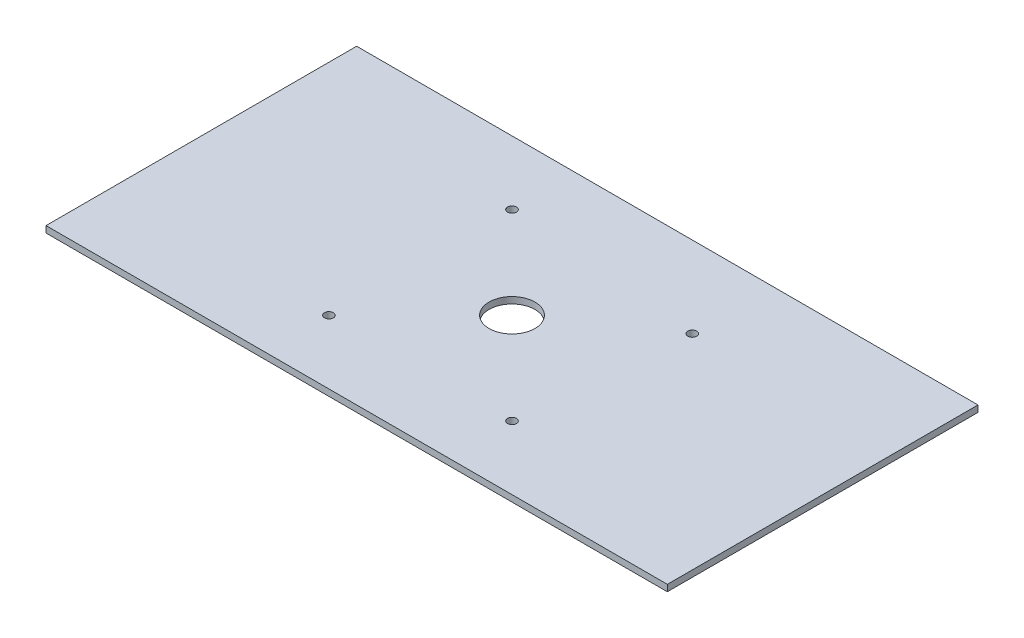
from build123d import *

# Parameters (mm, degrees)
SKETCH1_W           = 609.6
SKETCH1_H           = 304.8
SKETCH1_R           = 4.4
SKETCH1_R_2         = 22.5
BOSS_EXTRUDE1_DEPTH = 6.35


with BuildPart() as part:
    # Sketch1 → Boss-Extrude1 (new body)
    with BuildSketch(Plane(origin=(0, 0, 0), x_dir=(1, 0, 0), z_dir=(0, 1, 0))):
        Rectangle(SKETCH1_W, SKETCH1_H)
        with Locations(Location((-89.802561211, -89.802561211, 0), (0, 0, 270))):
            Circle(SKETCH1_R, mode=Mode.SUBTRACT)
        with Locations(Location((-89.802561211, 89.802561211, 0), (0, 0, 270))):
            Circle(SKETCH1_R, mode=Mode.SUBTRACT)
        with Locations(Location((104.032309625, 72.844207417, 0), (0, 0, 270))):
            Circle(SKETCH1_R, mode=Mode.SUBTRACT)
        with Locations(Location((89.802561211, -89.802561211, 0), (0, 0, 270))):
            Circle(SKETCH1_R, mode=Mode.SUBTRACT)
        with Locations(Location((0, 0, 0), (0, 0, 270))):
            Circle(SKETCH1_R_2, mode=Mode.SUBTRACT)
    extrude(amount=BOSS_EXTRUDE1_DEPTH)


solid = part.part
